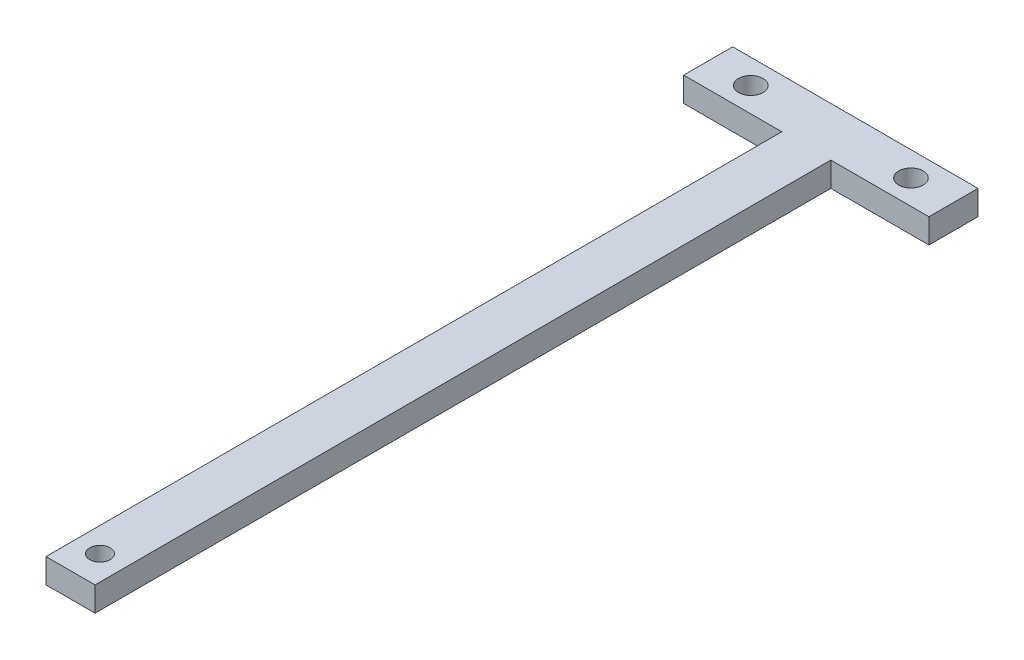
from build123d import *

# Parameters (mm, degrees)
SKETCH1_R           = 2.5
SKETCH1_R_2         = 2.095284192
BOSS_EXTRUDE1_DEPTH = 5


with BuildPart() as part:
    # Sketch1 → Boss-Extrude1 (new body)
    with BuildSketch(Plane(origin=(0, 0, 0), x_dir=(1, 0, 0), z_dir=(0, 1, 0))):
        Polygon((0, 0), (0, 150), (-20, 150), (-20, 160), (10, 160), (30, 160), (30, 150), (20, 150), (10, 150), (10, 0), align=None)
        with Locations(Location((-11.326905487, 155, 0), (0, 0, 270))):
            Circle(SKETCH1_R, mode=Mode.SUBTRACT)
        with Locations(Location((21.326905487, 155, 0), (0, 0, 270))):
            Circle(SKETCH1_R, mode=Mode.SUBTRACT)
        with Locations(Location((5, 6, 0), (0, 0, 270))):
            Circle(SKETCH1_R_2, mode=Mode.SUBTRACT)
    extrude(amount=BOSS_EXTRUDE1_DEPTH)


solid = part.part
